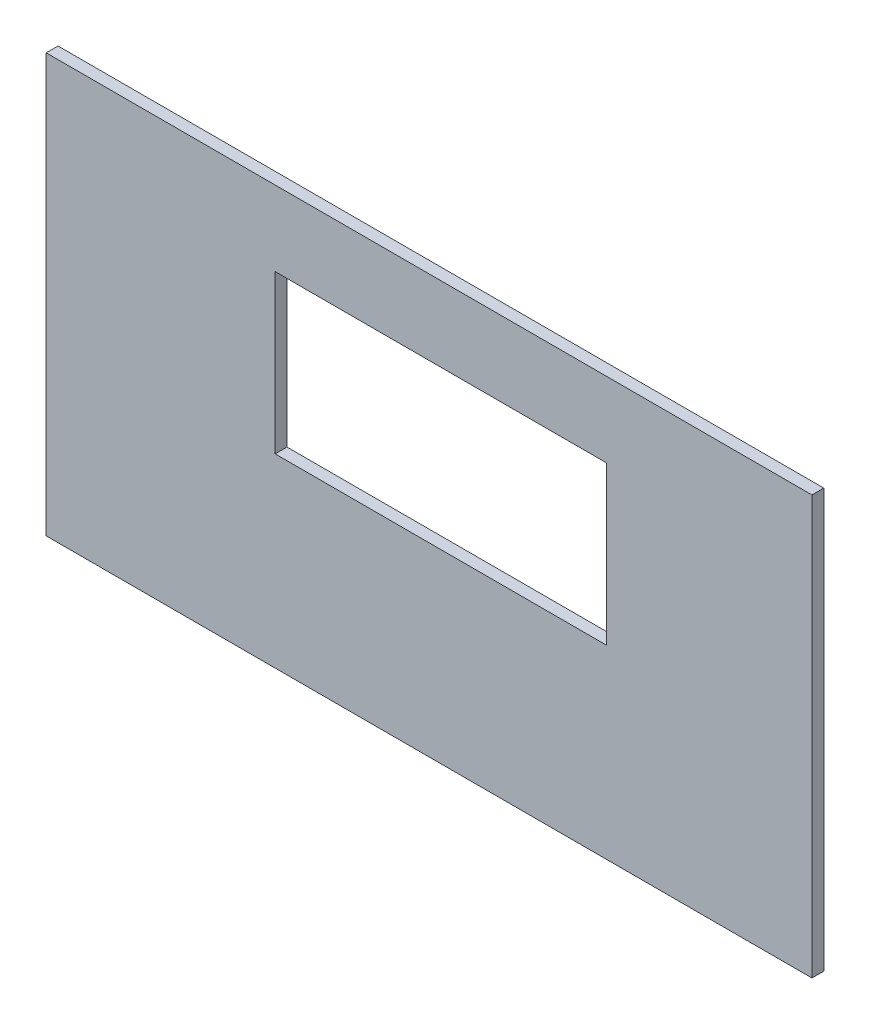
from build123d import *

# Parameters (mm, degrees)
SKETCH1_W     = 194
SKETCH1_H     = 106
SKETCH1_W_2   = 84
SKETCH1_H_2   = 40
PROFILE_DEPTH = 3


with BuildPart() as part:
    # Sketch1 → Profile (new body)
    with BuildSketch(Plane.XY):
        with Locations((97, 53)):
            Rectangle(SKETCH1_W, SKETCH1_H)
        with Locations((100, 67)):
            Rectangle(SKETCH1_W_2, SKETCH1_H_2, mode=Mode.SUBTRACT)
    extrude(amount=PROFILE_DEPTH)


solid = part.part
